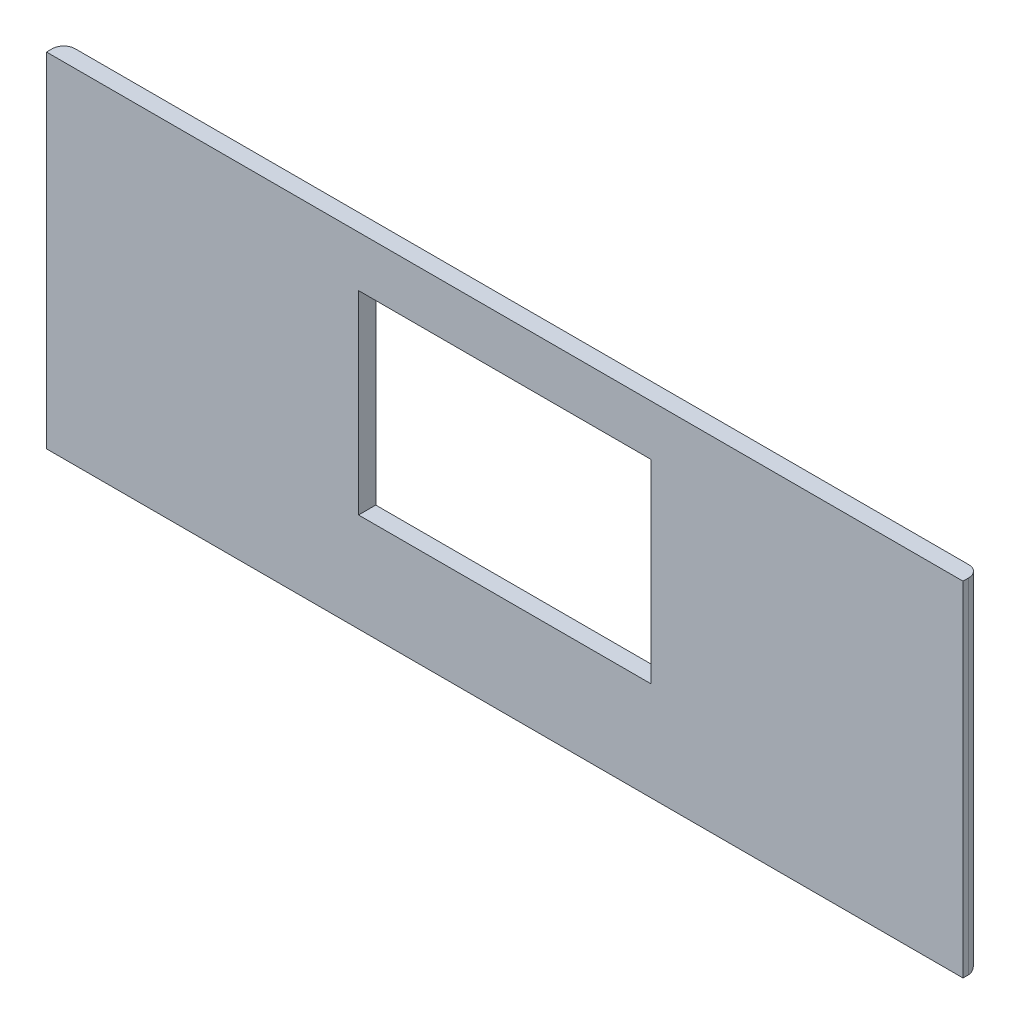
from build123d import *

# Parameters (mm, degrees)
SKETCH1_W           = 160
SKETCH1_H           = 60
BOSS_EXTRUDE1_DEPTH = 3
SKETCH2_W           = 51.046896962
SKETCH2_H           = 33.928778657
CUT_EXTRUDE1_DEPTH  = 171.906407136
FILLET1_R           = 2


with BuildPart() as part:
    # Sketch1 → Boss-Extrude1 (new body)
    with BuildSketch(Plane.XY):
        with Locations((80, 30)):
            Rectangle(SKETCH1_W, SKETCH1_H)
    extrude(amount=BOSS_EXTRUDE1_DEPTH)

    # Sketch2 → Cut-Extrude1 (cut, through all)
    with BuildSketch(Plane(origin=(0, 0, 0), x_dir=(-1, 0, 0), z_dir=(0, 0, -1))):
        with Locations((-80, 34.206093002)):
            Rectangle(SKETCH2_W, SKETCH2_H)
    extrude(amount=-CUT_EXTRUDE1_DEPTH, mode=Mode.SUBTRACT)

    # Fillet1
    fillet1_edges = [part.edges().sort_by_distance(p)[0] for p in [
        (160, 30, 0),
        (80, 0, 0),
        (0, 30, 0),
    ]]
    fillet(fillet1_edges, radius=FILLET1_R)


solid = part.part
